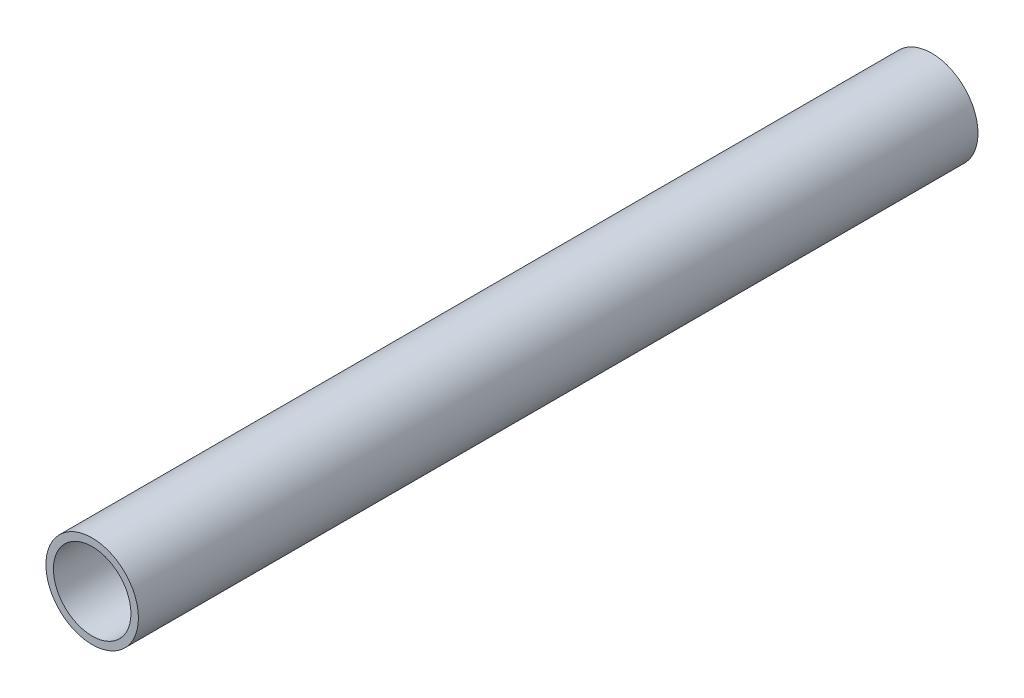
from build123d import *

# Parameters (mm, degrees)
SKETCH1_R           = 30.3
SKETCH1_R_2         = 25.4
BOSS_EXTRUDE1_DEPTH = 550


with BuildPart() as part:
    # Sketch1 → Boss-Extrude1 (new body)
    with BuildSketch(Plane.XY):
        Circle(SKETCH1_R)
        Circle(SKETCH1_R_2, mode=Mode.SUBTRACT)
    extrude(amount=BOSS_EXTRUDE1_DEPTH)


solid = part.part
